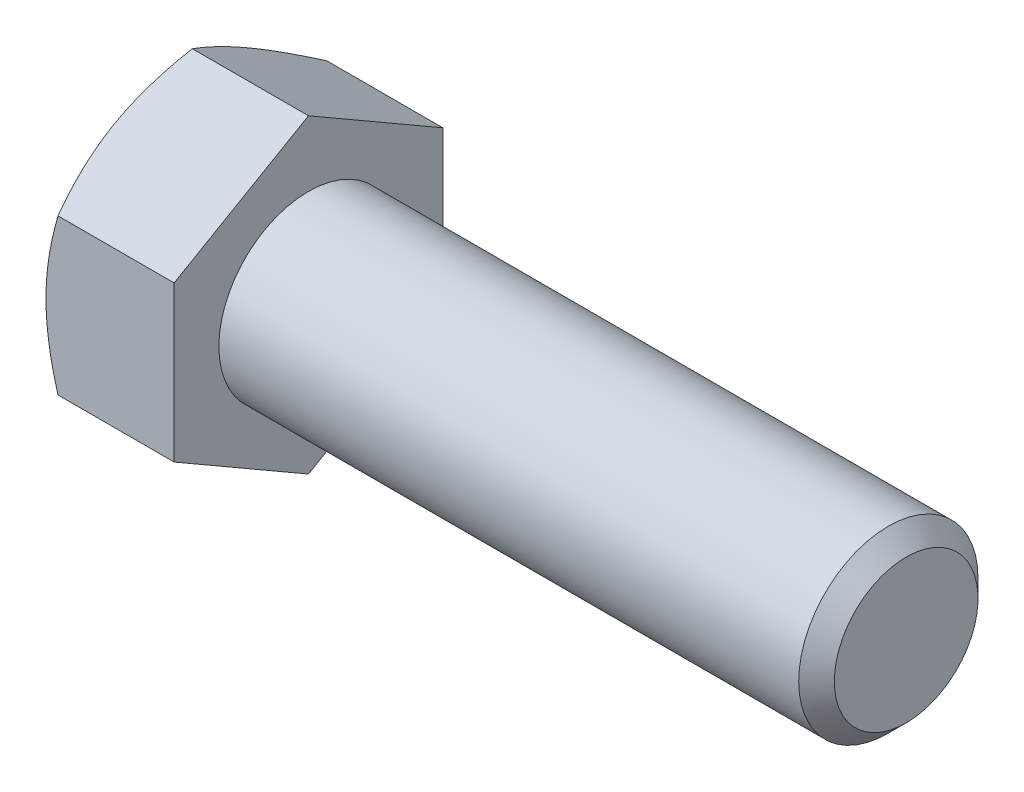
from build123d import *

# Parameters (mm, degrees)
BASEHEAD_DEPTH = 6.8072


with BuildPart() as part:
    # Sketch1 → BaseHead (new body)
    with BuildSketch(Plane(origin=(0, 0, 0), x_dir=(0, 0, -1), z_dir=(1, 0, 0))):
        Polygon((7.1374, 4.120779811), (7.1374, -4.120779811), (0, -8.241559623), (-7.1374, -4.120779811), (-7.1374, 4.120779811), (0, 8.241559623), align=None)
    extrude(amount=BASEHEAD_DEPTH)

    # BodySke → BaseBody (revolve)
    with BuildSketch(Plane.XY, mode=Mode.PRIVATE) as basebody_sk:
        Polygon((0, 0), (38.5572, 0), (38.5572, 3.81635), (37.61105, 4.7625), (0, 4.7625), align=None)
    revolve(basebody_sk.sketch.rotate(Axis((0, 0, 0), (1, 0, 0)), 90), axis=Axis((0, 0, 0), (1, 0, 0)))

    # Sketch3 → HeadChamfer (revolve, cut)
    with BuildSketch(Plane.XY):
        Polygon((0, 7.1374), (4.303661065, 14.591559623), (4.303661065, 20.941559623), (-12.7, 20.941559623), (-12.7, 7.1374), align=None)
    revolve(axis=Axis((0, 0, 0), (1, 0, 0)), mode=Mode.SUBTRACT)


solid = part.part
